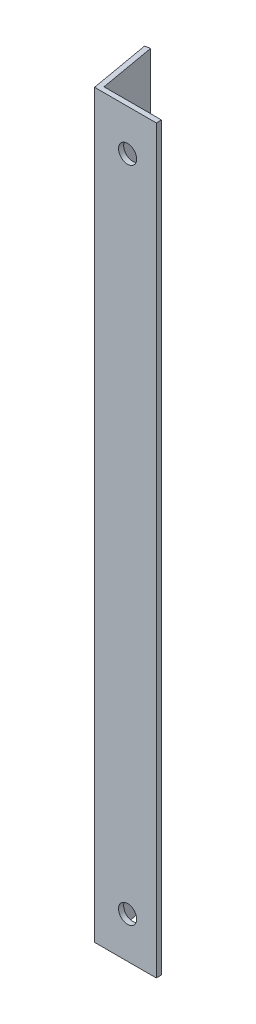
from build123d import *

# Parameters (mm, degrees)
BOSS_EXTRUDE1_DEPTH = 228.6
SKETCH19_R          = 5.588
CUT_EXTRUDE2_DEPTH  = 235.36596615


with BuildPart() as part:
    # Sketch18 → Boss-Extrude1 (new, symmetric)
    with BuildSketch(Plane(origin=(0, 0, 0), x_dir=(1, 0, 0), z_dir=(0, 1, 0))):
        Polygon((-3.489230953, 38.072508354), (2.664141329, 3.175), (38.1, 3.175), (38.1, 0), (0, 0), (-6.615995569, 37.52117539), align=None)
    extrude(amount=BOSS_EXTRUDE1_DEPTH, both=True)

    # Sketch19 → Cut-Extrude2 (cut, through all)
    with BuildSketch(Plane(origin=(0, 0, -3.175), x_dir=(-1, 0, 0), z_dir=(0, 0, -1))):
        with Locations((-20.382070664, 203.2)):
            Circle(SKETCH19_R)
    cut_extrude2 = extrude(amount=-CUT_EXTRUDE2_DEPTH, mode=Mode.SUBTRACT)

    # Mirror1: Cut-Extrude2 across plane
    add(cut_extrude2.mirror(Plane.ZX), mode=Mode.SUBTRACT)


solid = part.part
